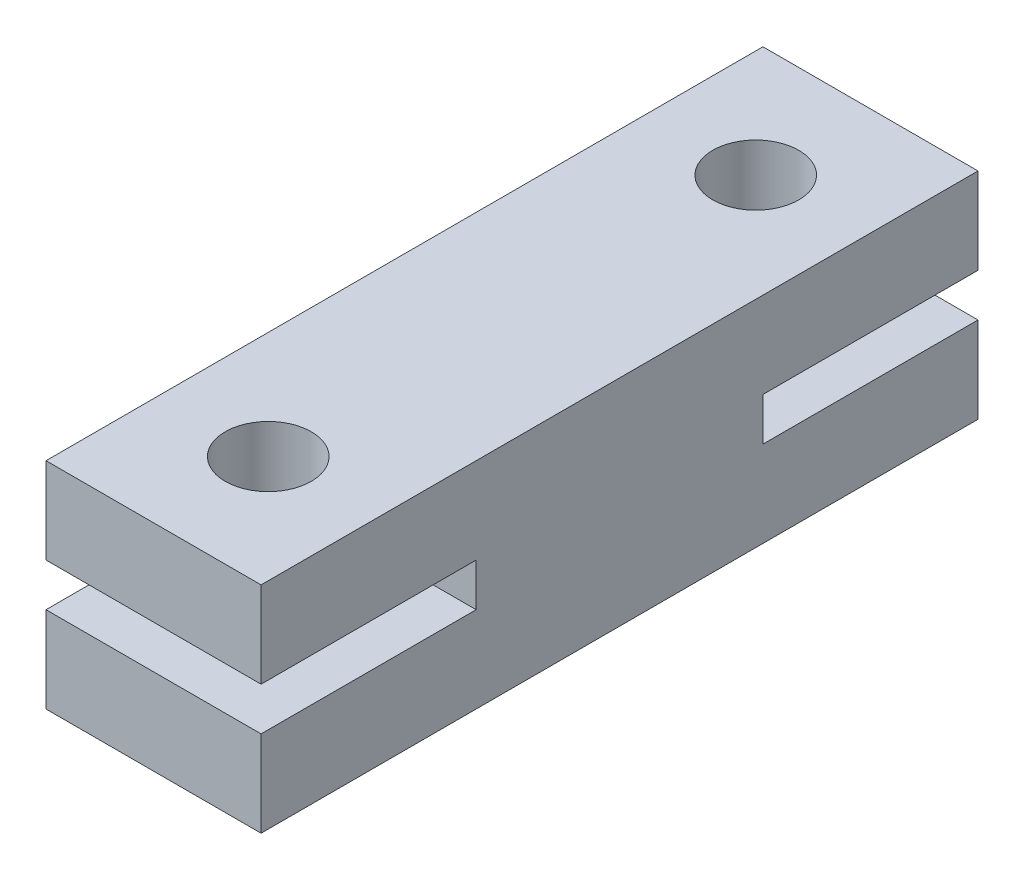
from build123d import *

# Parameters (mm, degrees)
ESQUISSE1_W             = 50
ESQUISSE1_H             = 15
BOSS_EXTRU_1_DEPTH      = 7.5
ESQUISSE3_R             = 3
ENL_V_MAT_EXTRU_2_DEPTH = 31.103986447
ESQUISSE4_W             = 15
ESQUISSE4_H             = 3
ENL_V_MAT_EXTRU_3_DEPTH = 15
ESQUISSE5_W             = 15
ESQUISSE5_H             = 3
ENL_V_MAT_EXTRU_4_DEPTH = 15


with BuildPart() as part:
    # Esquisse1 → Boss.-Extru.1 (new, symmetric)
    with BuildSketch(Plane(origin=(0, 0, 0), x_dir=(0, 0, -1), z_dir=(1, 0, 0))):
        Rectangle(ESQUISSE1_W, ESQUISSE1_H)
    extrude(amount=BOSS_EXTRU_1_DEPTH, both=True)

    # Esquisse3 → Enlèv. mat.-Extru.2 (cut, through all)
    with BuildSketch(Plane(origin=(0, 7.5, 0), x_dir=(1, 0, 0), z_dir=(0, 1, 0))):
        with Locations(Location((0, 17, 0), (0, 0, 270))):
            Circle(ESQUISSE3_R)
        with Locations(Location((0, -17, 0), (0, 0, 270))):
            Circle(ESQUISSE3_R)
    extrude(amount=-ENL_V_MAT_EXTRU_2_DEPTH, mode=Mode.SUBTRACT)

    # Esquisse4 → Enlèv. mat.-Extru.3 (cut)
    with BuildSketch(Plane.XY.offset(25)):
        Rectangle(ESQUISSE4_W, ESQUISSE4_H)
    extrude(amount=-ENL_V_MAT_EXTRU_3_DEPTH, mode=Mode.SUBTRACT)

    # Esquisse5 → Enlèv. mat.-Extru.4 (cut)
    with BuildSketch(Plane(origin=(0, 0, -25), x_dir=(-1, 0, 0), z_dir=(0, 0, -1))):
        Rectangle(ESQUISSE5_W, ESQUISSE5_H)
    extrude(amount=-ENL_V_MAT_EXTRU_4_DEPTH, mode=Mode.SUBTRACT)


solid = part.part
